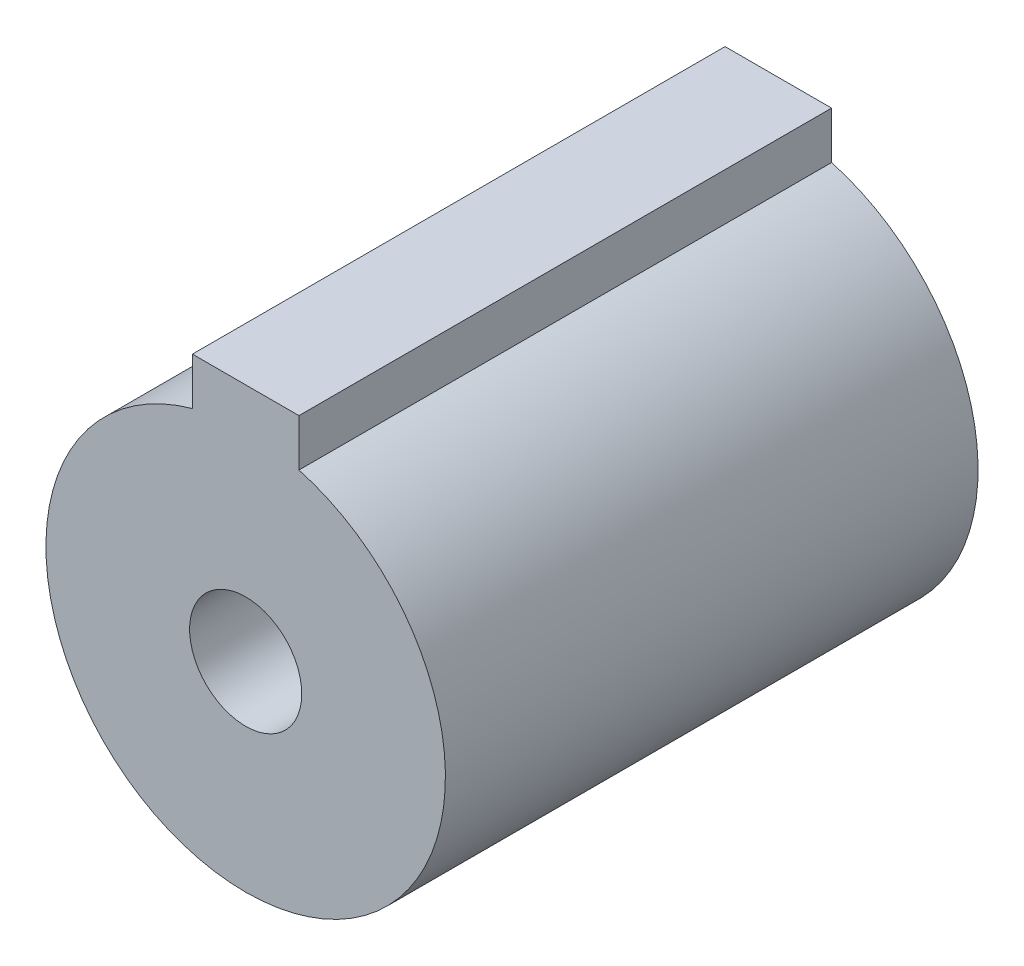
from build123d import *

# Parameters (mm, degrees)
BOSS_EXTRUDE1_DEPTH = 40
SKETCH2_R           = 4.21
CUT_EXTRUDE1_DEPTH  = 40


with BuildPart() as part:
    # Sketch1 → Boss-Extrude1 (new body)
    with BuildSketch(Plane.XY):
        with BuildLine():
            Line((4, 17.996832295), (-4, 17.996832295))
            Line((-4, 17.996832295), (-4, 14.456832295))
            ThreePointArc((-4, 14.456832295), (0, -15), (4, 14.456832295))
            Line((4, 14.456832295), (4, 17.996832295))
        make_face()
    extrude(amount=BOSS_EXTRUDE1_DEPTH)

    # Sketch2 → Cut-Extrude1 (cut)
    with BuildSketch(Plane.XY.offset(40)):
        Circle(SKETCH2_R)
    extrude(amount=-CUT_EXTRUDE1_DEPTH, mode=Mode.SUBTRACT)


solid = part.part
